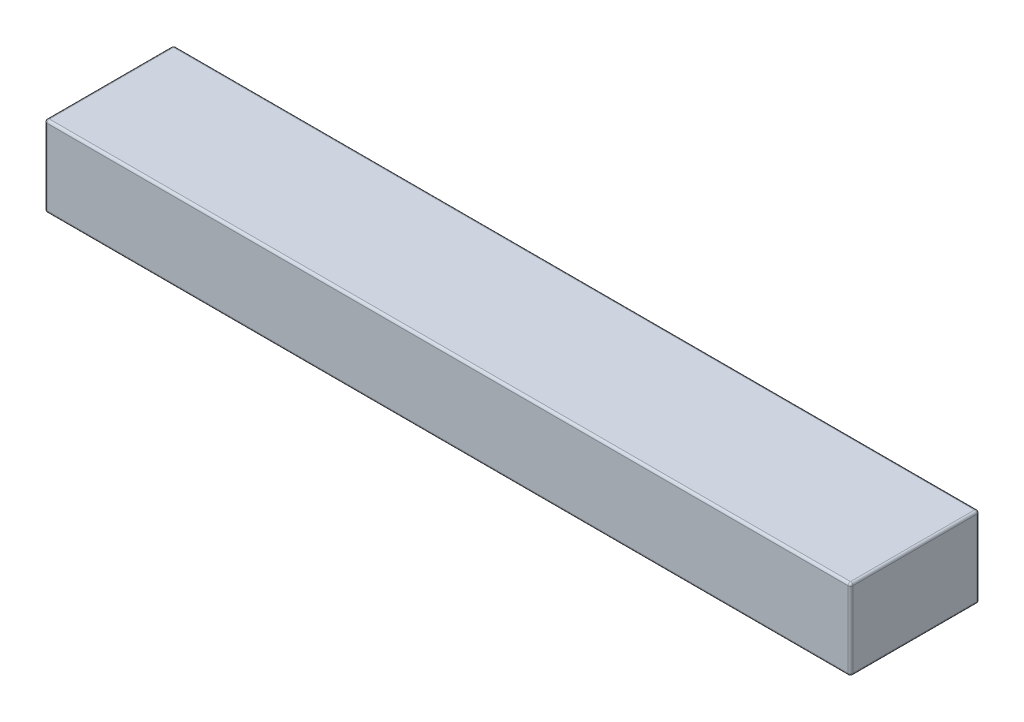
from build123d import *

# Parameters (mm, degrees)
BOSS_EXTRUDE1_DEPTH = 50
FILLET1_R           = 0.3


with BuildPart() as part:
    # Sketch1 → Boss-Extrude1 (new, symmetric)
    with BuildSketch(Plane(origin=(0, 0, 0), x_dir=(0, 0, -1), z_dir=(1, 0, 0))):
        with BuildLine():
            Line((-7.7, -5.7), (7.7, -5.7))
            ThreePointArc((7.7, -5.7), (7.912132034, -5.612132034), (8, -5.4))
            Line((8, -5.4), (8, 4))
            ThreePointArc((8, 4), (7.912132034, 4.212132034), (7.7, 4.3))
            Line((7.7, 4.3), (-7.7, 4.3))
            ThreePointArc((-7.7, 4.3), (-7.912132034, 4.212132034), (-8, 4))
            Line((-8, 4), (-8, -5.4))
            ThreePointArc((-8, -5.4), (-7.912132034, -5.612132034), (-7.7, -5.7))
        make_face()
    extrude(amount=BOSS_EXTRUDE1_DEPTH, both=True)

    # Fillet1
    fillet1_edges = [part.edges().sort_by_distance(p)[0] for p in [
        (-50, -0.7, -8),
        (-50, -5.612132034, -7.912132034),
        (-50, -5.7, 0),
        (-50, -5.612132034, 7.912132034),
        (50, -5.612132034, -7.912132034),
        (50, -0.7, -8),
        (50, 4.212132034, -7.912132034),
        (50, 4.3, 0),
        (50, 4.212132034, 7.912132034),
        (50, -0.7, 8),
        (50, -5.612132034, 7.912132034),
        (-50, -0.7, 8),
        (50, -5.7, 0),
        (-50, 4.212132034, 7.912132034),
        (-50, 4.3, 0),
        (-50, 4.212132034, -7.912132034),
    ]]
    fillet(fillet1_edges, radius=FILLET1_R)


solid = part.part
